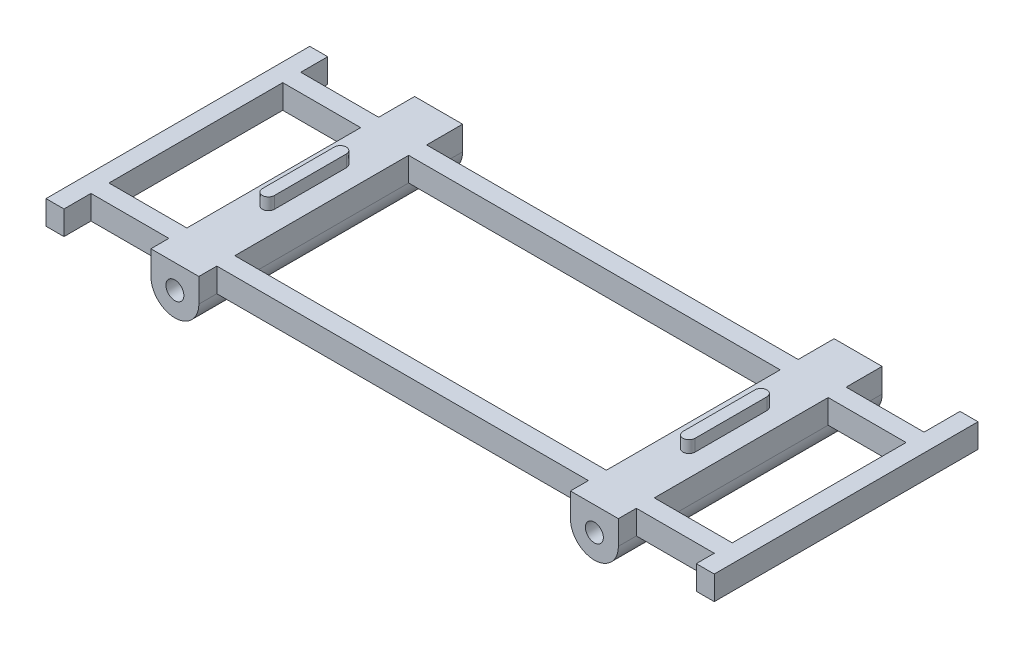
from build123d import *

# Parameters (mm, degrees)
SKETCH1_W           = 15
SKETCH1_H           = 220
SKETCH1_W_2         = 519.948861259
SKETCH1_H_2         = 15
BOSS_EXTRUDE1_DEPTH = 20
BOSS_EXTRUDE3_DEPTH = 110
SKETCH3_R           = 7.5
CUT_EXTRUDE1_DEPTH  = 655.346046928
BOSS_EXTRUDE5_DEPTH = 10


with BuildPart() as part:
    # Sketch1 → Boss-Extrude1 (new body)
    with BuildSketch(Plane(origin=(0, 0, 0), x_dir=(1, 0, 0), z_dir=(0, 1, 0))):
        with Locations((72.505405333, -7.5)):
            Rectangle(SKETCH1_W, SKETCH1_H)
        with Locations((607.454266592, 0)):
            Rectangle(SKETCH1_W, SKETCH1_H)
        with Locations((339.979835963, 72.5)):
            Rectangle(SKETCH1_W_2, SKETCH1_H_2)
        with Locations((339.979835963, -87.5)):
            Rectangle(SKETCH1_W_2, SKETCH1_H_2)
    extrude(amount=-BOSS_EXTRUDE1_DEPTH)

    # Sketch2 → Boss-Extrude3 (add, symmetric)
    with BuildSketch(Plane.XY):
        with BuildLine():
            Line((145.005405333, 0), (185.005405333, 0))
            Line((185.005405333, 0), (185.005405333, -20))
            ThreePointArc((185.005405333, -20), (165.005392368, -39.99997407), (145.005405333, -19.99997407))
            Line((145.005405333, -19.99997407), (145.005405333, 0))
        make_face()
        with BuildLine():
            Line((494.954266592, 0), (534.954266592, 0))
            Line((534.954266592, 0), (534.954266592, -20))
            ThreePointArc((534.954266592, -20), (514.954261153, -39.999989122), (494.954266592, -19.999989122))
            Line((494.954266592, -19.999989122), (494.954266592, 0))
        make_face()
    extrude(amount=BOSS_EXTRUDE3_DEPTH, both=True)

    # Sketch3 → Cut-Extrude1 (cut, through all)
    with BuildSketch(Plane.XY.offset(110)):
        with Locations((165.005405333, -19.99997407)):
            Circle(SKETCH3_R)
        with Locations((514.954266592, -19.999989122)):
            Circle(SKETCH3_R)
    extrude(amount=-CUT_EXTRUDE1_DEPTH, mode=Mode.SUBTRACT)

    # Sketch4 → Boss-Extrude5 (add)
    with BuildSketch(Plane(origin=(0, 0, 0), x_dir=(1, 0, 0), z_dir=(0, 1, 0))):
        with BuildLine():
            Line((158.022043154, -30), (158.022043154, 30))
            ThreePointArc((158.022043154, 30), (163.022043154, 35), (168.022043154, 30))
            Line((168.022043154, 30), (168.022043154, -30))
            ThreePointArc((168.022043154, -30), (163.022043154, -35), (158.022043154, -30))
        make_face()
        with BuildLine():
            Line((508.880344162, -30), (508.880344162, 30))
            ThreePointArc((508.880344162, 30), (513.880344162, 35), (518.880344162, 30))
            Line((518.880344162, 30), (518.880344162, -30))
            ThreePointArc((518.880344162, -30), (513.880344162, -35), (508.880344162, -30))
        make_face()
    extrude(amount=BOSS_EXTRUDE5_DEPTH)


solid = part.part
